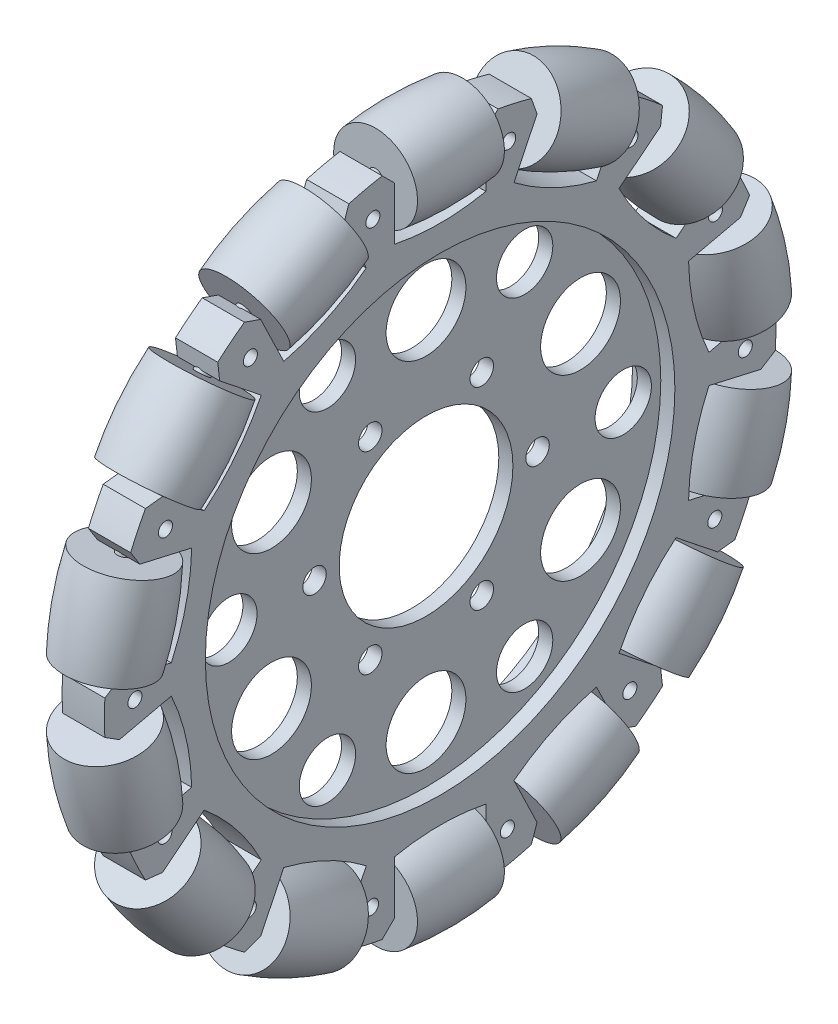
from build123d import *

# Parameters (mm, degrees)
SKETCH1_R           = 18.5
SKETCH1_R_2         = 2.5
SKETCH1_R_3         = 6
SKETCH1_R_4         = 8.5
SKETCH1_R_5         = 1.5
BOSS_EXTRUDE1_DEPTH = 3
SKETCH2_R           = 50
SKETCH2_R_2         = 1.5
BOSS_EXTRUDE2_DEPTH = 3
LPATTERN1_COUNT     = 2
LPATTERN1_PITCH     = 6
CIRPATTERN1_COUNT   = 14


with BuildPart() as part:
    # Sketch1 → Boss-Extrude1 (new body)
    with BuildSketch(Plane(origin=(0, 0, 0), x_dir=(0, 0, -1), z_dir=(1, 0, 0))):
        with BuildLine():
            Line((-9.75, 67.832107833), (-9.75, 56.5))
            ThreePointArc((-9.75, 56.5), (0, 55.5), (9.75, 56.5))
            Line((9.75, 56.5), (9.75, 67.832107833))
            Line((9.75, 67.832107833), (12.344235589, 70.426343422))
            ThreePointArc((12.344235589, 70.426343422), (15.910246778, 69.707345721), (19.435073252, 68.807905997))
            Line((19.435073252, 68.807905997), (20.646802117, 65.344983858))
            Line((20.646802117, 65.344983858), (15.729984798, 55.135107493))
            ThreePointArc((15.729984798, 55.135107493), (24.080547521, 50.003772169), (33.298877722, 46.67437458))
            Line((33.298877722, 46.67437458), (38.215695041, 56.884250945))
            Line((38.215695041, 56.884250945), (41.67861718, 58.095979809))
            ThreePointArc((41.67861718, 58.095979809), (44.579520833, 55.900950996), (47.365027481, 53.561218916))
            Line((47.365027481, 53.561218916), (46.954251858, 49.915484426))
            Line((46.954251858, 49.915484426), (38.094453191, 42.850030759))
            ThreePointArc((38.094453191, 42.850030759), (43.391647277, 34.603684003), (50.252504328, 27.604316851))
            Line((50.252504328, 27.604316851), (59.112302994, 34.669770518))
            Line((59.112302994, 34.669770518), (62.758037484, 34.258994895))
            ThreePointArc((62.758037484, 34.258994895), (64.419274055, 31.022687347), (65.913757122, 27.706075544))
            Line((65.913757122, 27.706075544), (63.961836162, 24.599611131))
            Line((63.961836162, 24.599611131), (52.913847932, 22.077979912))
            ThreePointArc((52.913847932, 22.077979912), (54.108499126, 12.349911835), (57.253006144, 3.066885625))
            Line((57.253006144, 3.066885625), (68.300994374, 5.588516843))
            Line((68.300994374, 5.588516843), (71.407458787, 3.636595883))
            ThreePointArc((71.407458787, 3.636595883), (71.5, 0), (71.407458787, -3.636595883))
            Line((71.407458787, -3.636595883), (68.300994374, -5.588516843))
            Line((68.300994374, -5.588516843), (57.253006144, -3.066885625))
            ThreePointArc((57.253006144, -3.066885625), (54.108499126, -12.349911835), (52.913847932, -22.077979912))
            Line((52.913847932, -22.077979912), (63.961836162, -24.599611131))
            Line((63.961836162, -24.599611131), (65.913757122, -27.706075544))
            ThreePointArc((65.913757122, -27.706075544), (64.419274055, -31.022687347), (62.758037484, -34.258994895))
            Line((62.758037484, -34.258994895), (59.112302994, -34.669770518))
            Line((59.112302994, -34.669770518), (50.252504328, -27.604316851))
            ThreePointArc((50.252504328, -27.604316851), (43.391647277, -34.603684003), (38.094453191, -42.850030759))
            Line((38.094453191, -42.850030759), (46.954251858, -49.915484426))
            Line((46.954251858, -49.915484426), (47.365027481, -53.561218916))
            ThreePointArc((47.365027481, -53.561218916), (44.579520833, -55.900950996), (41.67861718, -58.095979809))
            Line((41.67861718, -58.095979809), (38.215695041, -56.884250945))
            Line((38.215695041, -56.884250945), (33.298877722, -46.67437458))
            ThreePointArc((33.298877722, -46.67437458), (24.080547521, -50.003772169), (15.729984798, -55.135107493))
            Line((15.729984798, -55.135107493), (20.646802117, -65.344983858))
            Line((20.646802117, -65.344983858), (19.435073252, -68.807905997))
            ThreePointArc((19.435073252, -68.807905997), (15.910246778, -69.707345721), (12.344235589, -70.426343422))
            Line((12.344235589, -70.426343422), (9.75, -67.832107833))
            Line((9.75, -67.832107833), (9.75, -56.5))
            ThreePointArc((9.75, -56.5), (0, -55.5), (-9.75, -56.5))
            Line((-9.75, -56.5), (-9.75, -67.832107833))
            Line((-9.75, -67.832107833), (-12.344235589, -70.426343422))
            ThreePointArc((-12.344235589, -70.426343422), (-15.910246778, -69.707345721), (-19.435073252, -68.807905997))
            Line((-19.435073252, -68.807905997), (-20.646802117, -65.344983858))
            Line((-20.646802117, -65.344983858), (-15.729984798, -55.135107493))
            ThreePointArc((-15.729984798, -55.135107493), (-24.080547521, -50.003772169), (-33.298877722, -46.67437458))
            Line((-33.298877722, -46.67437458), (-38.215695041, -56.884250945))
            Line((-38.215695041, -56.884250945), (-41.67861718, -58.095979809))
            ThreePointArc((-41.67861718, -58.095979809), (-44.579520833, -55.900950996), (-47.365027481, -53.561218916))
            Line((-47.365027481, -53.561218916), (-46.954251858, -49.915484426))
            Line((-46.954251858, -49.915484426), (-38.094453191, -42.850030759))
            ThreePointArc((-38.094453191, -42.850030759), (-43.391647277, -34.603684003), (-50.252504328, -27.604316851))
            Line((-50.252504328, -27.604316851), (-59.112302994, -34.669770518))
            Line((-59.112302994, -34.669770518), (-62.758037484, -34.258994895))
            ThreePointArc((-62.758037484, -34.258994895), (-64.419274055, -31.022687347), (-65.913757122, -27.706075544))
            Line((-65.913757122, -27.706075544), (-63.961836162, -24.599611131))
            Line((-63.961836162, -24.599611131), (-52.913847932, -22.077979912))
            ThreePointArc((-52.913847932, -22.077979912), (-54.108499126, -12.349911835), (-57.253006144, -3.066885625))
            Line((-57.253006144, -3.066885625), (-68.300994374, -5.588516843))
            Line((-68.300994374, -5.588516843), (-71.407458787, -3.636595883))
            ThreePointArc((-71.407458787, -3.636595883), (-71.5, 0), (-71.407458787, 3.636595883))
            Line((-71.407458787, 3.636595883), (-68.300994374, 5.588516843))
            Line((-68.300994374, 5.588516843), (-57.253006144, 3.066885625))
            ThreePointArc((-57.253006144, 3.066885625), (-54.108499126, 12.349911835), (-52.913847932, 22.077979912))
            Line((-52.913847932, 22.077979912), (-63.961836162, 24.599611131))
            Line((-63.961836162, 24.599611131), (-65.913757122, 27.706075544))
            ThreePointArc((-65.913757122, 27.706075544), (-64.419274055, 31.022687347), (-62.758037484, 34.258994895))
            Line((-62.758037484, 34.258994895), (-59.112302994, 34.669770518))
            Line((-59.112302994, 34.669770518), (-50.252504328, 27.604316851))
            ThreePointArc((-50.252504328, 27.604316851), (-43.391647277, 34.603684003), (-38.094453191, 42.850030759))
            Line((-38.094453191, 42.850030759), (-46.954251858, 49.915484426))
            Line((-46.954251858, 49.915484426), (-47.365027481, 53.561218916))
            ThreePointArc((-47.365027481, 53.561218916), (-44.579520833, 55.900950996), (-41.67861718, 58.095979809))
            Line((-41.67861718, 58.095979809), (-38.215695041, 56.884250945))
            Line((-38.215695041, 56.884250945), (-33.298877722, 46.67437458))
            ThreePointArc((-33.298877722, 46.67437458), (-24.080547521, 50.003772169), (-15.729984798, 55.135107493))
            Line((-15.729984798, 55.135107493), (-20.646802117, 65.344983858))
            Line((-20.646802117, 65.344983858), (-19.435073252, 68.807905997))
            ThreePointArc((-19.435073252, 68.807905997), (-15.910246778, 69.707345721), (-12.344235589, 70.426343422))
            Line((-12.344235589, 70.426343422), (-9.75, 67.832107833))
        make_face()
        Circle(SKETCH1_R, mode=Mode.SUBTRACT)
        with Locations((-23.75, 0)):
            Circle(SKETCH1_R_2, mode=Mode.SUBTRACT)
        with Locations((-42, 0)):
            Circle(SKETCH1_R_3, mode=Mode.SUBTRACT)
        with Locations((-32.908965344, 19)):
            Circle(SKETCH1_R_4, mode=Mode.SUBTRACT)
        with Locations((0, 38)):
            Circle(SKETCH1_R_4, mode=Mode.SUBTRACT)
        with Locations((-21, 36.373066959)):
            Circle(SKETCH1_R_3, mode=Mode.SUBTRACT)
        with Locations((-11.875, 20.56810334)):
            Circle(SKETCH1_R_2, mode=Mode.SUBTRACT)
        with Locations((32.908965344, 19)):
            Circle(SKETCH1_R_4, mode=Mode.SUBTRACT)
        with Locations((21, 36.373066959)):
            Circle(SKETCH1_R_3, mode=Mode.SUBTRACT)
        with Locations((11.875, 20.56810334)):
            Circle(SKETCH1_R_2, mode=Mode.SUBTRACT)
        with Locations((32.908965344, -19)):
            Circle(SKETCH1_R_4, mode=Mode.SUBTRACT)
        with Locations((42, 0)):
            Circle(SKETCH1_R_3, mode=Mode.SUBTRACT)
        with Locations((23.75, 0)):
            Circle(SKETCH1_R_2, mode=Mode.SUBTRACT)
        with Locations((0, -38)):
            Circle(SKETCH1_R_4, mode=Mode.SUBTRACT)
        with Locations((21, -36.373066959)):
            Circle(SKETCH1_R_3, mode=Mode.SUBTRACT)
        with Locations((11.875, -20.56810334)):
            Circle(SKETCH1_R_2, mode=Mode.SUBTRACT)
        with Locations((-32.908965344, -19)):
            Circle(SKETCH1_R_4, mode=Mode.SUBTRACT)
        with Locations((-21, -36.373066959)):
            Circle(SKETCH1_R_3, mode=Mode.SUBTRACT)
        with Locations((-11.875, -20.56810334)):
            Circle(SKETCH1_R_2, mode=Mode.SUBTRACT)
        with Locations((-14.320889801, 63.402776874)):
            Circle(SKETCH1_R_5, mode=Mode.SUBTRACT)
        with Locations((14.606758029, 63.337529316)):
            Circle(SKETCH1_R_5, mode=Mode.SUBTRACT)
        with Locations((40.641358291, 50.727507294)):
            Circle(SKETCH1_R_5, mode=Mode.SUBTRACT)
        with Locations((58.62643911, 28.07028032)):
            Circle(SKETCH1_R_5, mode=Mode.SUBTRACT)
        with Locations((64.999834658, -0.146609931)):
            Circle(SKETCH1_R_5, mode=Mode.SUBTRACT)
        with Locations((58.49921578, -28.334462287)):
            Circle(SKETCH1_R_5, mode=Mode.SUBTRACT)
        with Locations((40.412109772, -50.910326887)):
            Circle(SKETCH1_R_5, mode=Mode.SUBTRACT)
        with Locations((14.320889801, -63.402776874)):
            Circle(SKETCH1_R_5, mode=Mode.SUBTRACT)
        with Locations((-14.606758029, -63.337529316)):
            Circle(SKETCH1_R_5, mode=Mode.SUBTRACT)
        with Locations((-40.641358291, -50.727507294)):
            Circle(SKETCH1_R_5, mode=Mode.SUBTRACT)
        with Locations((-58.62643911, -28.07028032)):
            Circle(SKETCH1_R_5, mode=Mode.SUBTRACT)
        with Locations((-64.999834658, 0.146609931)):
            Circle(SKETCH1_R_5, mode=Mode.SUBTRACT)
        with Locations((-58.49921578, 28.334462287)):
            Circle(SKETCH1_R_5, mode=Mode.SUBTRACT)
        with Locations((-40.412109772, 50.910326887)):
            Circle(SKETCH1_R_5, mode=Mode.SUBTRACT)
    extrude(amount=BOSS_EXTRUDE1_DEPTH)

    # Sketch2 → Boss-Extrude2 (add)
    with BuildSketch(Plane(origin=(3, 0, 0), x_dir=(0, 0, -1), z_dir=(1, 0, 0))):
        with BuildLine():
            Line((9.75, 67.832107833), (9.75, 56.5))
            ThreePointArc((9.75, 56.5), (0, 55.5), (-9.75, 56.5))
            Line((-9.75, 56.5), (-9.75, 67.832107833))
            Line((-9.75, 67.832107833), (-12.344235589, 70.426343422))
            ThreePointArc((-12.344235589, 70.426343422), (-15.910246778, 69.707345721), (-19.435073252, 68.807905997))
            Line((-19.435073252, 68.807905997), (-20.646802117, 65.344983858))
            Line((-20.646802117, 65.344983858), (-15.729984798, 55.135107493))
            ThreePointArc((-15.729984798, 55.135107493), (-24.080547521, 50.003772169), (-33.298877722, 46.67437458))
            Line((-33.298877722, 46.67437458), (-38.215695041, 56.884250945))
            Line((-38.215695041, 56.884250945), (-41.67861718, 58.095979809))
            ThreePointArc((-41.67861718, 58.095979809), (-44.579520833, 55.900950996), (-47.365027481, 53.561218916))
            Line((-47.365027481, 53.561218916), (-46.954251858, 49.915484426))
            Line((-46.954251858, 49.915484426), (-38.094453191, 42.850030759))
            ThreePointArc((-38.094453191, 42.850030759), (-43.391647277, 34.603684003), (-50.252504328, 27.604316851))
            Line((-50.252504328, 27.604316851), (-59.112302994, 34.669770518))
            Line((-59.112302994, 34.669770518), (-62.758037484, 34.258994895))
            ThreePointArc((-62.758037484, 34.258994895), (-64.419274055, 31.022687347), (-65.913757122, 27.706075544))
            Line((-65.913757122, 27.706075544), (-63.961836162, 24.599611131))
            Line((-63.961836162, 24.599611131), (-52.913847932, 22.077979912))
            ThreePointArc((-52.913847932, 22.077979912), (-54.108499126, 12.349911835), (-57.253006144, 3.066885625))
            Line((-57.253006144, 3.066885625), (-68.300994374, 5.588516843))
            Line((-68.300994374, 5.588516843), (-71.407458787, 3.636595883))
            ThreePointArc((-71.407458787, 3.636595883), (-71.5, 0), (-71.407458787, -3.636595883))
            Line((-71.407458787, -3.636595883), (-68.300994374, -5.588516843))
            Line((-68.300994374, -5.588516843), (-57.253006144, -3.066885625))
            ThreePointArc((-57.253006144, -3.066885625), (-54.108499126, -12.349911835), (-52.913847932, -22.077979912))
            Line((-52.913847932, -22.077979912), (-63.961836162, -24.599611131))
            Line((-63.961836162, -24.599611131), (-65.913757122, -27.706075544))
            ThreePointArc((-65.913757122, -27.706075544), (-64.419274055, -31.022687347), (-62.758037484, -34.258994895))
            Line((-62.758037484, -34.258994895), (-59.112302994, -34.669770518))
            Line((-59.112302994, -34.669770518), (-50.252504328, -27.604316851))
            ThreePointArc((-50.252504328, -27.604316851), (-43.391647277, -34.603684003), (-38.094453191, -42.850030759))
            Line((-38.094453191, -42.850030759), (-46.954251858, -49.915484426))
            Line((-46.954251858, -49.915484426), (-47.365027481, -53.561218916))
            ThreePointArc((-47.365027481, -53.561218916), (-44.579520833, -55.900950996), (-41.67861718, -58.095979809))
            Line((-41.67861718, -58.095979809), (-38.215695041, -56.884250945))
            Line((-38.215695041, -56.884250945), (-33.298877722, -46.67437458))
            ThreePointArc((-33.298877722, -46.67437458), (-24.080547521, -50.003772169), (-15.729984798, -55.135107493))
            Line((-15.729984798, -55.135107493), (-20.646802117, -65.344983858))
            Line((-20.646802117, -65.344983858), (-19.435073252, -68.807905997))
            ThreePointArc((-19.435073252, -68.807905997), (-15.910246778, -69.707345721), (-12.344235589, -70.426343422))
            Line((-12.344235589, -70.426343422), (-9.75, -67.832107833))
            Line((-9.75, -67.832107833), (-9.75, -56.5))
            ThreePointArc((-9.75, -56.5), (0, -55.5), (9.75, -56.5))
            Line((9.75, -56.5), (9.75, -67.832107833))
            Line((9.75, -67.832107833), (12.344235589, -70.426343422))
            ThreePointArc((12.344235589, -70.426343422), (15.910246778, -69.707345721), (19.435073252, -68.807905997))
            Line((19.435073252, -68.807905997), (20.646802117, -65.344983858))
            Line((20.646802117, -65.344983858), (15.729984798, -55.135107493))
            ThreePointArc((15.729984798, -55.135107493), (24.080547521, -50.003772169), (33.298877722, -46.67437458))
            Line((33.298877722, -46.67437458), (38.215695041, -56.884250945))
            Line((38.215695041, -56.884250945), (41.67861718, -58.095979809))
            ThreePointArc((41.67861718, -58.095979809), (44.579520833, -55.900950996), (47.365027481, -53.561218916))
            Line((47.365027481, -53.561218916), (46.954251858, -49.915484426))
            Line((46.954251858, -49.915484426), (38.094453191, -42.850030759))
            ThreePointArc((38.094453191, -42.850030759), (43.391647277, -34.603684003), (50.252504328, -27.604316851))
            Line((50.252504328, -27.604316851), (59.112302994, -34.669770518))
            Line((59.112302994, -34.669770518), (62.758037484, -34.258994895))
            ThreePointArc((62.758037484, -34.258994895), (64.419274055, -31.022687347), (65.913757122, -27.706075544))
            Line((65.913757122, -27.706075544), (63.961836162, -24.599611131))
            Line((63.961836162, -24.599611131), (52.913847932, -22.077979912))
            ThreePointArc((52.913847932, -22.077979912), (54.108499126, -12.349911835), (57.253006144, -3.066885625))
            Line((57.253006144, -3.066885625), (68.300994374, -5.588516843))
            Line((68.300994374, -5.588516843), (71.407458787, -3.636595883))
            ThreePointArc((71.407458787, -3.636595883), (71.5, 0), (71.407458787, 3.636595883))
            Line((71.407458787, 3.636595883), (68.300994374, 5.588516843))
            Line((68.300994374, 5.588516843), (57.253006144, 3.066885625))
            ThreePointArc((57.253006144, 3.066885625), (54.108499126, 12.349911835), (52.913847932, 22.077979912))
            Line((52.913847932, 22.077979912), (63.961836162, 24.599611131))
            Line((63.961836162, 24.599611131), (65.913757122, 27.706075544))
            ThreePointArc((65.913757122, 27.706075544), (64.419274055, 31.022687347), (62.758037484, 34.258994895))
            Line((62.758037484, 34.258994895), (59.112302994, 34.669770518))
            Line((59.112302994, 34.669770518), (50.252504328, 27.604316851))
            ThreePointArc((50.252504328, 27.604316851), (43.391647277, 34.603684003), (38.094453191, 42.850030759))
            Line((38.094453191, 42.850030759), (46.954251858, 49.915484426))
            Line((46.954251858, 49.915484426), (47.365027481, 53.561218916))
            ThreePointArc((47.365027481, 53.561218916), (44.579520833, 55.900950996), (41.67861718, 58.095979809))
            Line((41.67861718, 58.095979809), (38.215695041, 56.884250945))
            Line((38.215695041, 56.884250945), (33.298877722, 46.67437458))
            ThreePointArc((33.298877722, 46.67437458), (24.080547521, 50.003772169), (15.729984798, 55.135107493))
            Line((15.729984798, 55.135107493), (20.646802117, 65.344983858))
            Line((20.646802117, 65.344983858), (19.435073252, 68.807905997))
            ThreePointArc((19.435073252, 68.807905997), (15.910246778, 69.707345721), (12.344235589, 70.426343422))
            Line((12.344235589, 70.426343422), (9.75, 67.832107833))
        make_face()
        Circle(SKETCH2_R, mode=Mode.SUBTRACT)
        with Locations((14.606758029, 63.337529316)):
            Circle(SKETCH2_R_2, mode=Mode.SUBTRACT)
        with Locations((-14.320889801, 63.402776874)):
            Circle(SKETCH2_R_2, mode=Mode.SUBTRACT)
        with Locations((40.641358291, 50.727507294)):
            Circle(SKETCH2_R_2, mode=Mode.SUBTRACT)
        with Locations((58.62643911, 28.07028032)):
            Circle(SKETCH2_R_2, mode=Mode.SUBTRACT)
        with Locations((64.999834658, -0.146609931)):
            Circle(SKETCH2_R_2, mode=Mode.SUBTRACT)
        with Locations((58.49921578, -28.334462287)):
            Circle(SKETCH2_R_2, mode=Mode.SUBTRACT)
        with Locations((40.412109772, -50.910326887)):
            Circle(SKETCH2_R_2, mode=Mode.SUBTRACT)
        with Locations((14.320889801, -63.402776874)):
            Circle(SKETCH2_R_2, mode=Mode.SUBTRACT)
        with Locations((-14.606758029, -63.337529316)):
            Circle(SKETCH2_R_2, mode=Mode.SUBTRACT)
        with Locations((-40.641358291, -50.727507294)):
            Circle(SKETCH2_R_2, mode=Mode.SUBTRACT)
        with Locations((-58.62643911, -28.07028032)):
            Circle(SKETCH2_R_2, mode=Mode.SUBTRACT)
        with Locations((-64.999834658, 0.146609931)):
            Circle(SKETCH2_R_2, mode=Mode.SUBTRACT)
        with Locations((-58.49921578, 28.334462287)):
            Circle(SKETCH2_R_2, mode=Mode.SUBTRACT)
        with Locations((-40.412109772, 50.910326887)):
            Circle(SKETCH2_R_2, mode=Mode.SUBTRACT)
    boss_extrude2 = extrude(amount=BOSS_EXTRUDE2_DEPTH)

    # LPattern1: Boss-Extrude2 ×2
    with Locations(*[(-i * LPATTERN1_PITCH, 0, 0) for i in range(1, LPATTERN1_COUNT)]):
        add(boss_extrude2)

    # Sketch3 → Revolve1 (revolve)
    with BuildSketch(Plane(origin=(1.5, 0, 0), x_dir=(0, 0, -1), z_dir=(1, 0, 0)), mode=Mode.PRIVATE) as revolve1_sk:
        with BuildLine():
            Line((-9.25, 75.434988566), (-9.25, 68))
            Line((-9.25, 68), (-11.378512277, 68))
            Line((-11.378512277, 68), (-11.378512277, 66.5))
            Line((-11.378512277, 66.5), (-9.25, 66.5))
            Line((-9.25, 66.5), (9.25, 66.5))
            Line((9.25, 66.5), (11.378512277, 66.5))
            Line((11.378512277, 66.5), (11.378512277, 68))
            Line((11.378512277, 68), (9.25, 68))
            Line((9.25, 68), (9.25, 75.434988566))
            ThreePointArc((9.25, 75.434988566), (0, 76), (-9.25, 75.434988566))
        make_face()
    revolve1 = revolve(revolve1_sk.sketch.rotate(Axis((1.5, 66.5, -9.25), (0, 0, 1)), 90), axis=Axis((1.5, 66.5, -9.25), (0, 0, 1)))

    # CirPattern1: Revolve1 ×14 about axis
    cirpattern1_axis = Axis((0, 0, 0), (1, 0, 0))
    for i in range(1, CIRPATTERN1_COUNT):
        add(revolve1.rotate(cirpattern1_axis, i * 360 / CIRPATTERN1_COUNT))


solid = part.part
